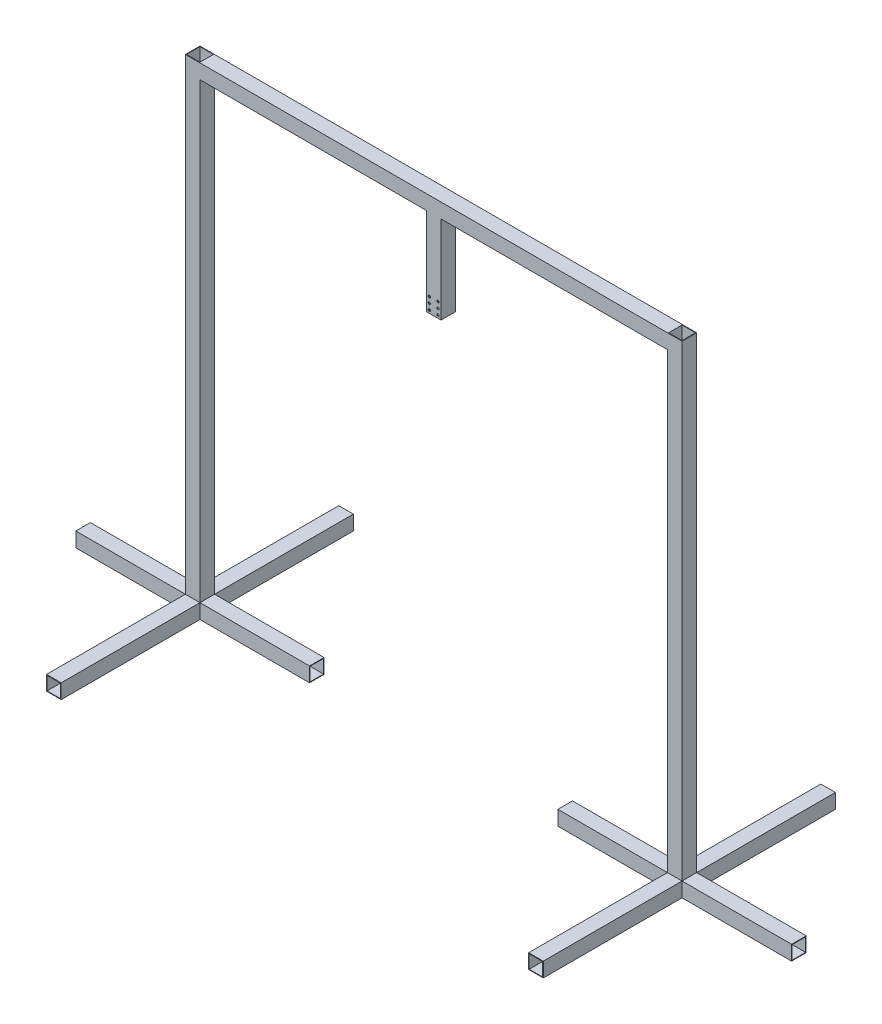
from build123d import *

# Parameters (mm, degrees)
SKETCH1_W           = 25
SKETCH1_H           = 25
SKETCH1_W_2         = 23
SKETCH1_H_2         = 23
BOSS_EXTRUDE1_DEPTH = 250
SKETCH2_W           = 25
SKETCH2_H           = 25
SKETCH2_W_2         = 23
SKETCH2_H_2         = 23
BOSS_EXTRUDE2_DEPTH = 200
SKETCH4_W           = 25
SKETCH4_H           = 25
CUT_EXTRUDE6_DEPTH  = 25
BOSS_EXTRUDE3_START = -12.5
SKETCH3_W           = 25
SKETCH3_H           = 25
SKETCH3_W_2         = 23
SKETCH3_H_2         = 23
BOSS_EXTRUDE3_DEPTH = 825
SKETCH5_W           = 25
SKETCH5_H           = 25
SKETCH5_W_2         = 23
SKETCH5_H_2         = 23
BOSS_EXTRUDE4_DEPTH = 400
SKETCH6_W           = 25
SKETCH6_H           = 25
SKETCH6_W_2         = 23
SKETCH6_H_2         = 23
BOSS_EXTRUDE5_DEPTH = 150
SKETCH7_R           = 2
CUT_EXTRUDE7_DEPTH  = 25


with BuildPart() as part:
    # Sketch1 → Boss-Extrude1 (new, symmetric)
    with BuildSketch(Plane.XY):
        Rectangle(SKETCH1_W, SKETCH1_H)
        Rectangle(SKETCH1_W_2, SKETCH1_H_2, mode=Mode.SUBTRACT)
    boss_extrude1 = extrude(amount=BOSS_EXTRUDE1_DEPTH, both=True)

    # Sketch2 → Boss-Extrude2 (add, symmetric)
    with BuildSketch(Plane(origin=(0, 0, 0), x_dir=(0, 0, -1), z_dir=(1, 0, 0))):
        Rectangle(SKETCH2_W, SKETCH2_H)
        Rectangle(SKETCH2_W_2, SKETCH2_H_2, mode=Mode.SUBTRACT)
    boss_extrude2 = extrude(amount=BOSS_EXTRUDE2_DEPTH, both=True)

    # Sketch4 → Cut-Extrude6 (cut)
    with BuildSketch(Plane.XZ.offset(12.5)):
        Rectangle(SKETCH4_W, SKETCH4_H)
    cut_extrude6 = extrude(amount=-CUT_EXTRUDE6_DEPTH, mode=Mode.SUBTRACT)


with BuildPart() as cut_extrude6_piece_1:
    # of the separate pieces the step leaves, piece 1, a body of its own (cut_extrude6_pieces)
    add(part.part.solids().sort_by_distance((-12.5, 12.5, -250))[0])



with BuildPart() as cut_extrude6_piece_2:
    # of the separate pieces the step leaves, piece 2, a body of its own (cut_extrude6_pieces)
    add(part.part.solids().sort_by_distance((-12.5, 12.5, 250))[0])


with BuildPart() as cut_extrude6_piece_3:
    # of the separate pieces the step leaves, piece 3, a body of its own (cut_extrude6_pieces)
    add(part.part.solids().sort_by_distance((-200, 12.5, -12.5))[0])


with BuildPart() as cut_extrude6_piece_4:
    # of the separate pieces the step leaves, piece 4, a body of its own (cut_extrude6_pieces)
    add(part.part.solids().sort_by_distance((200, 12.5, 12.5))[0])


with BuildPart() as cut_extrude6_piece_1_1:
    add(cut_extrude6_piece_1.part)

    add(cut_extrude6_piece_2.part)  # Boss-Extrude3 merges Cut-Extrude6 piece 2

    add(cut_extrude6_piece_3.part)  # Boss-Extrude3 merges Cut-Extrude6 piece 3

    add(cut_extrude6_piece_4.part)  # Boss-Extrude3 merges Cut-Extrude6 piece 4
    # Sketch3 → Boss-Extrude3 (add)
    with BuildSketch(Plane(origin=(0, 0, 0), x_dir=(1, 0, 0), z_dir=(0, 1, 0)).offset(BOSS_EXTRUDE3_START)):
        Rectangle(SKETCH3_W, SKETCH3_H)
        Rectangle(SKETCH3_W_2, SKETCH3_H_2, mode=Mode.SUBTRACT)
    boss_extrude3 = extrude(amount=BOSS_EXTRUDE3_DEPTH)

    # Sketch5 → Boss-Extrude4 (add)
    with BuildSketch(Plane.ZY.offset(12.5)):
        with Locations((0, 800)):
            Rectangle(SKETCH5_W, SKETCH5_H)
        with Locations((0, 800)):
            Rectangle(SKETCH5_W_2, SKETCH5_H_2, mode=Mode.SUBTRACT)
    boss_extrude4 = extrude(amount=BOSS_EXTRUDE4_DEPTH)

    # Mirror1: Boss-Extrude1, Boss-Extrude2, Cut-Extrude6, Boss-Extrude3, Boss-Extrude4 across plane
    add(boss_extrude1.mirror(Plane.ZY.offset(412.5)))
    add(boss_extrude2.mirror(Plane.ZY.offset(412.5)))
    add(cut_extrude6.mirror(Plane.ZY.offset(412.5)), mode=Mode.SUBTRACT)
    add(boss_extrude3.mirror(Plane.ZY.offset(412.5)))
    add(boss_extrude4.mirror(Plane.ZY.offset(412.5)))

    # Sketch6 → Boss-Extrude5 (add)
    with BuildSketch(Plane.XZ.offset(-787.5)):
        with Locations((-412.5, 0)):
            Rectangle(SKETCH6_W, SKETCH6_H)
        with Locations((-412.5, 0)):
            Rectangle(SKETCH6_W_2, SKETCH6_H_2, mode=Mode.SUBTRACT)
    extrude(amount=BOSS_EXTRUDE5_DEPTH)

    # Sketch7 → Cut-Extrude7 (cut)
    with BuildSketch(Plane.XY.offset(12.5)):
        with Locations((-420, 662.5)):
            Circle(SKETCH7_R)
        with Locations((-405, 662.5)):
            Circle(SKETCH7_R)
        with Locations((-420, 652.5)):
            Circle(SKETCH7_R)
        with Locations((-405, 652.5)):
            Circle(SKETCH7_R)
        with Locations((-420, 642.5)):
            Circle(SKETCH7_R)
        with Locations((-405, 642.5)):
            Circle(SKETCH7_R)
    extrude(amount=-CUT_EXTRUDE7_DEPTH, mode=Mode.SUBTRACT)


solid = cut_extrude6_piece_1_1.part
